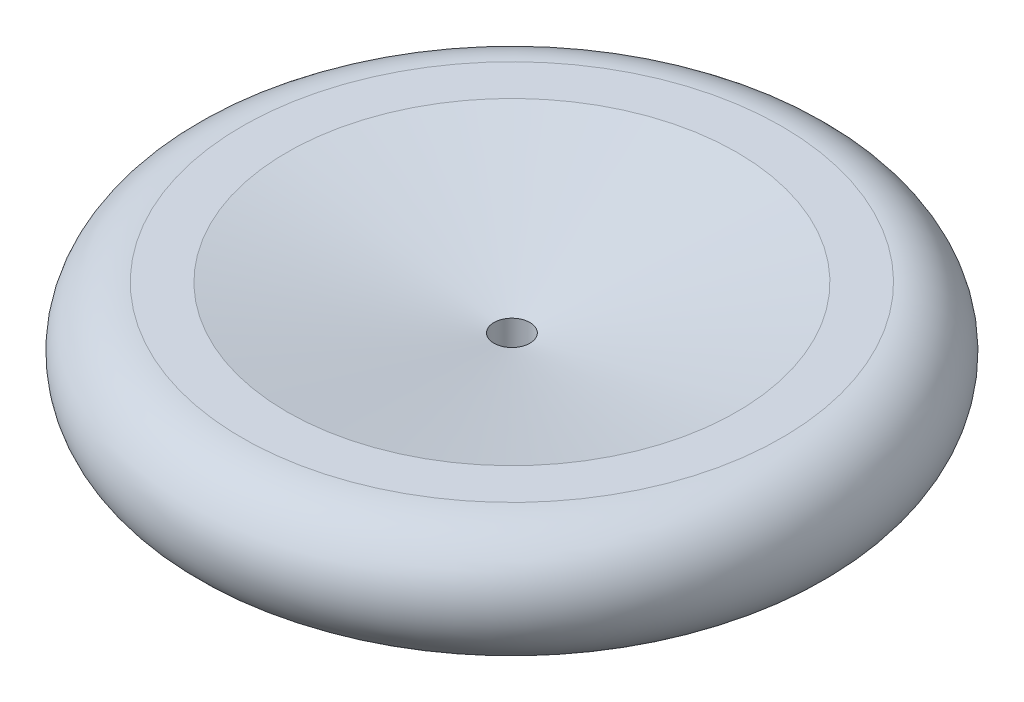
from build123d import *


with BuildPart() as part:
    # Sketch1 → Revolve1 (revolve)
    with BuildSketch(Plane.XY, mode=Mode.PRIVATE) as revolve1_sk:
        with BuildLine():
            Line((50, -13.277601837), (60, -13.277601837))
            ThreePointArc((60, -13.277601837), (73.277601837, 0), (60, 13.277601837))
            Line((60, 13.277601837), (50, 13.277601837))
            Line((50, 13.277601837), (4, 3.5))
            Line((4, 3.5), (4, 0))
            Line((4, 0), (4, -3.5))
            Line((4, -3.5), (50, -13.277601837))
        make_face()
    revolve(revolve1_sk.sketch.rotate(Axis((0, 0, 0), (0, 1, 0)), 90), axis=Axis((0, 0, 0), (0, 1, 0)))


solid = part.part
